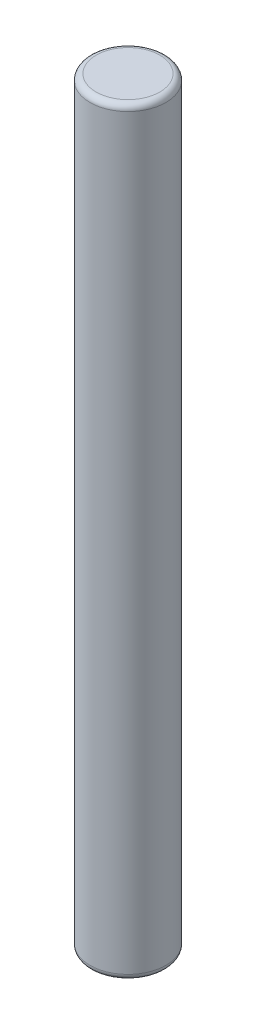
from build123d import *

# Parameters (mm, degrees)
SKETCH1_R           = 1.5875
BOSS_EXTRUDE1_DEPTH = 31.75
FILLET2_R           = 0.254
FILLET3_R           = 0.254


with BuildPart() as part:
    # Sketch1 → Boss-Extrude1 (new body)
    with BuildSketch(Plane(origin=(0, 0, 0), x_dir=(1, 0, 0), z_dir=(0, 1, 0))):
        with Locations(Location((0, 0, 0), (0, 0, 270))):
            Circle(SKETCH1_R)
    extrude(amount=BOSS_EXTRUDE1_DEPTH)

    # Fillet2
    fillet2_edges = [part.edges().sort_by_distance(p)[0] for p in [
        (0, 31.75, -1.5875),
    ]]
    fillet(fillet2_edges, radius=FILLET2_R)

    # Fillet3
    fillet3_edges = [part.edges().sort_by_distance(p)[0] for p in [
        (0, 0, -1.5875),
    ]]
    fillet(fillet3_edges, radius=FILLET3_R)


solid = part.part
